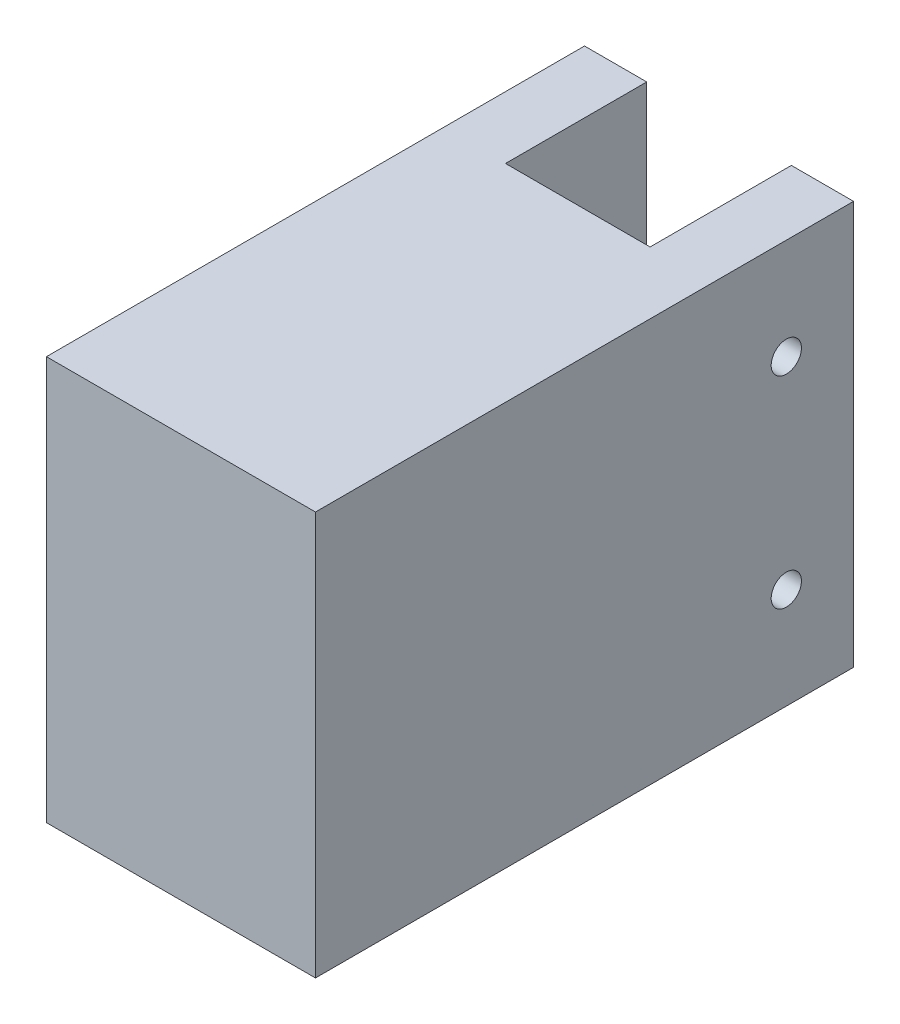
from build123d import *

# Parameters (mm, degrees)
SKETCH1_W           = 60
SKETCH1_H           = 60
SKETCH1_R           = 17.65
BOSS_EXTRUDE1_DEPTH = 40
SKETCH4_W           = 10
SKETCH4_H           = 60
BOSS_EXTRUDE2_DEPTH = 20
SKETCH5_R           = 2.25
CUT_EXTRUDE1_DEPTH  = 71.710678119
BOSS_EXTRUDE3_START = -15
SKETCH6_R           = 17.65
BOSS_EXTRUDE3_DEPTH = 15
SKETCH7_W           = 21.5
SKETCH7_H           = 21
CUT_EXTRUDE2_DEPTH  = 88.749643874


with BuildPart() as part:
    # Sketch1 → Boss-Extrude1 (new body)
    with BuildSketch(Plane(origin=(0, 0, 0), x_dir=(0, 0, -1), z_dir=(1, 0, 0))):
        Rectangle(SKETCH1_W, SKETCH1_H)
        Circle(SKETCH1_R, mode=Mode.SUBTRACT)
    extrude(amount=BOSS_EXTRUDE1_DEPTH)

    # Sketch4 → Boss-Extrude2 (add)
    with BuildSketch(Plane(origin=(0, 0, -30), x_dir=(-1, 0, 0), z_dir=(0, 0, -1))):
        with Locations((-35, 0)):
            Rectangle(SKETCH4_W, SKETCH4_H)
    boss_extrude2 = extrude(amount=BOSS_EXTRUDE2_DEPTH)

    # Sketch5 → Cut-Extrude1 (cut, through all)
    with BuildSketch(Plane(origin=(40, 0, 0), x_dir=(0, 0, -1), z_dir=(1, 0, 0))):
        with Locations((40, -15)):
            Circle(SKETCH5_R)
        with Locations(Location((40, 15, 0), (0, 0, 90))):
            Circle(SKETCH5_R)
    cut_extrude1 = extrude(amount=-CUT_EXTRUDE1_DEPTH, mode=Mode.SUBTRACT)

    # Mirror1: Boss-Extrude2, Cut-Extrude1 across plane
    add(boss_extrude2.mirror(Plane(origin=(20, 0, 0), x_dir=(0, 0, 1), z_dir=(1, 0, 0))))
    add(cut_extrude1.mirror(Plane(origin=(20, 0, 0), x_dir=(0, 0, 1), z_dir=(1, 0, 0))), mode=Mode.SUBTRACT)

    # Sketch6 → Boss-Extrude3 (add)
    with BuildSketch(Plane(origin=(40, 0, 0), x_dir=(0, 0, -1), z_dir=(1, 0, 0)).offset(BOSS_EXTRUDE3_START)):
        Circle(SKETCH6_R)
    extrude(amount=BOSS_EXTRUDE3_DEPTH)

    # Sketch7 → Cut-Extrude2 (cut, through all)
    with BuildSketch(Plane(origin=(0, 30, 0), x_dir=(1, 0, 0), z_dir=(0, 1, 0))):
        with Locations((20, 39.5)):
            Rectangle(SKETCH7_W, SKETCH7_H)
    extrude(amount=-CUT_EXTRUDE2_DEPTH, mode=Mode.SUBTRACT)


solid = part.part
